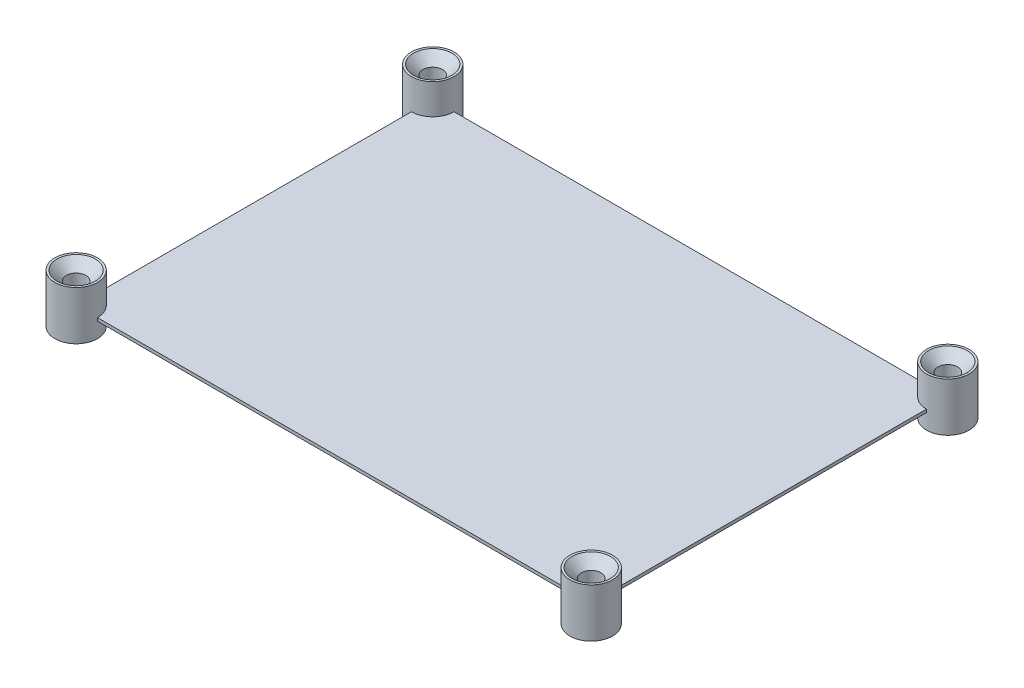
from build123d import *

# Parameters (mm, degrees)
SKETCH2_W                                       = 84.5
SKETCH2_H                                       = 58.5
BOSS_EXTRUDE1_DEPTH                             = 0.5
BOSS_EXTRUDE2_DEPTH                             = 5
BOSS_EXTRUDE2_DEPTH_BACK                        = 3
SKETCH3_R                                       = 3.5
BOSS_EXTRUDE3_DEPTH                             = 5
BOSS_EXTRUDE3_DEPTH_BACK                        = 3
SKETCH5_R                                       = 3.5
BOSS_EXTRUDE4_DEPTH                             = 5
BOSS_EXTRUDE4_DEPTH_BACK                        = 3
SKETCH6_R                                       = 3.5
BOSS_EXTRUDE5_DEPTH                             = 5
BOSS_EXTRUDE5_DEPTH_BACK                        = 3
SKETCH7_R                                       = 3.5
CSK_FOR_M3_FLAT_HEAD_MACHINE_SCREW1_D           = 3.2
CSK_FOR_M3_FLAT_HEAD_MACHINE_SCREW1_DEPTH       = 13.03862301
CSK_FOR_M3_FLAT_HEAD_MACHINE_SCREW1_CSINK_D     = 6.3
CSK_FOR_M3_FLAT_HEAD_MACHINE_SCREW1_CSINK_ANGLE = 90
CSK_FOR_M3_FLAT_HEAD_MACHINE_SCREW1_TIP         = 0.96137699
CSK_FOR_M3_FLAT_HEAD_MACHINE_SCREW2_D           = 3.2
CSK_FOR_M3_FLAT_HEAD_MACHINE_SCREW2_DEPTH       = 13.03862301
CSK_FOR_M3_FLAT_HEAD_MACHINE_SCREW2_CSINK_D     = 6.3
CSK_FOR_M3_FLAT_HEAD_MACHINE_SCREW2_CSINK_ANGLE = 90
CSK_FOR_M3_FLAT_HEAD_MACHINE_SCREW2_TIP         = 0.96137699
CSK_FOR_M3_FLAT_HEAD_MACHINE_SCREW3_D           = 3.2
CSK_FOR_M3_FLAT_HEAD_MACHINE_SCREW3_DEPTH       = 13.03862301
CSK_FOR_M3_FLAT_HEAD_MACHINE_SCREW3_CSINK_D     = 6.3
CSK_FOR_M3_FLAT_HEAD_MACHINE_SCREW3_CSINK_ANGLE = 90
CSK_FOR_M3_FLAT_HEAD_MACHINE_SCREW3_TIP         = 0.96137699
CSK_FOR_M3_FLAT_HEAD_MACHINE_SCREW4_D           = 3.2
CSK_FOR_M3_FLAT_HEAD_MACHINE_SCREW4_DEPTH       = 13.03862301
CSK_FOR_M3_FLAT_HEAD_MACHINE_SCREW4_CSINK_D     = 6.3
CSK_FOR_M3_FLAT_HEAD_MACHINE_SCREW4_CSINK_ANGLE = 90
CSK_FOR_M3_FLAT_HEAD_MACHINE_SCREW4_TIP         = 0.96137699


with BuildPart() as part:
    # Sketch2 → Boss-Extrude1 (new body)
    with BuildSketch(Plane(origin=(0, 0, 0), x_dir=(1, 0, 0), z_dir=(0, 1, 0))):
        with Locations((-42.25, -29.25)):
            Rectangle(SKETCH2_W, SKETCH2_H)
    extrude(amount=BOSS_EXTRUDE1_DEPTH)

    # Sketch3 → Boss-Extrude2 (add, two sides: drawn at the far end of the back side and taken through both)
    with BuildSketch(Plane(origin=(0, 0.5, 0), x_dir=(1, 0, 0), z_dir=(0, 1, 0)).offset(-BOSS_EXTRUDE2_DEPTH_BACK)):
        with Locations(Location((-84.5, 0, 0), (0, 0, 270))):
            Circle(SKETCH3_R)
    extrude(amount=BOSS_EXTRUDE2_DEPTH + BOSS_EXTRUDE2_DEPTH_BACK)

    # Sketch5 → Boss-Extrude3 (add, two sides: drawn at the far end of the back side and taken through both)
    with BuildSketch(Plane(origin=(0, 0.5, 0), x_dir=(1, 0, 0), z_dir=(0, 1, 0)).offset(-BOSS_EXTRUDE3_DEPTH_BACK)):
        with Locations(Location((-84.5, -58.5, 0), (0, 0, 270))):
            Circle(SKETCH5_R)
    extrude(amount=BOSS_EXTRUDE3_DEPTH + BOSS_EXTRUDE3_DEPTH_BACK)

    # Sketch6 → Boss-Extrude4 (add, two sides: drawn at the far end of the back side and taken through both)
    with BuildSketch(Plane(origin=(0, 0.5, 0), x_dir=(1, 0, 0), z_dir=(0, 1, 0)).offset(-BOSS_EXTRUDE4_DEPTH_BACK)):
        with Locations(Location((0, -58.5, 0), (0, 0, 270))):
            Circle(SKETCH6_R)
    extrude(amount=BOSS_EXTRUDE4_DEPTH + BOSS_EXTRUDE4_DEPTH_BACK)

    # Sketch7 → Boss-Extrude5 (add, two sides: drawn at the far end of the back side and taken through both)
    with BuildSketch(Plane(origin=(0, 0.5, 0), x_dir=(1, 0, 0), z_dir=(0, 1, 0)).offset(-BOSS_EXTRUDE5_DEPTH_BACK)):
        with Locations(Location((0, 0, 0), (0, 0, 270))):
            Circle(SKETCH7_R)
    extrude(amount=BOSS_EXTRUDE5_DEPTH + BOSS_EXTRUDE5_DEPTH_BACK)

    # CSK for M3 Flat Head Machine Screw1
    with Locations(Plane(origin=(0, 5.5, 0), x_dir=(1, 0, 0), z_dir=(0, 1, 0))):
        with Locations((-84.5, 0)):
            CounterSinkHole(CSK_FOR_M3_FLAT_HEAD_MACHINE_SCREW1_D / 2, CSK_FOR_M3_FLAT_HEAD_MACHINE_SCREW1_CSINK_D / 2, depth=CSK_FOR_M3_FLAT_HEAD_MACHINE_SCREW1_DEPTH, counter_sink_angle=CSK_FOR_M3_FLAT_HEAD_MACHINE_SCREW1_CSINK_ANGLE)
            with Locations((0, 0, -(CSK_FOR_M3_FLAT_HEAD_MACHINE_SCREW1_DEPTH + CSK_FOR_M3_FLAT_HEAD_MACHINE_SCREW1_TIP / 2))):  # 118° drill point
                Cone(0, CSK_FOR_M3_FLAT_HEAD_MACHINE_SCREW1_D / 2, CSK_FOR_M3_FLAT_HEAD_MACHINE_SCREW1_TIP, mode=Mode.SUBTRACT)

    # CSK for M3 Flat Head Machine Screw2
    with Locations(Plane(origin=(0, 5.5, 0), x_dir=(1, 0, 0), z_dir=(0, 1, 0))):
        with Locations((-84.5, -58.5)):
            CounterSinkHole(CSK_FOR_M3_FLAT_HEAD_MACHINE_SCREW2_D / 2, CSK_FOR_M3_FLAT_HEAD_MACHINE_SCREW2_CSINK_D / 2, depth=CSK_FOR_M3_FLAT_HEAD_MACHINE_SCREW2_DEPTH, counter_sink_angle=CSK_FOR_M3_FLAT_HEAD_MACHINE_SCREW2_CSINK_ANGLE)
            with Locations((0, 0, -(CSK_FOR_M3_FLAT_HEAD_MACHINE_SCREW2_DEPTH + CSK_FOR_M3_FLAT_HEAD_MACHINE_SCREW2_TIP / 2))):  # 118° drill point
                Cone(0, CSK_FOR_M3_FLAT_HEAD_MACHINE_SCREW2_D / 2, CSK_FOR_M3_FLAT_HEAD_MACHINE_SCREW2_TIP, mode=Mode.SUBTRACT)

    # CSK for M3 Flat Head Machine Screw3
    with Locations(Plane(origin=(0, 5.5, 0), x_dir=(1, 0, 0), z_dir=(0, 1, 0))):
        with Locations((0, 0)):
            CounterSinkHole(CSK_FOR_M3_FLAT_HEAD_MACHINE_SCREW3_D / 2, CSK_FOR_M3_FLAT_HEAD_MACHINE_SCREW3_CSINK_D / 2, depth=CSK_FOR_M3_FLAT_HEAD_MACHINE_SCREW3_DEPTH, counter_sink_angle=CSK_FOR_M3_FLAT_HEAD_MACHINE_SCREW3_CSINK_ANGLE)
            with Locations((0, 0, -(CSK_FOR_M3_FLAT_HEAD_MACHINE_SCREW3_DEPTH + CSK_FOR_M3_FLAT_HEAD_MACHINE_SCREW3_TIP / 2))):  # 118° drill point
                Cone(0, CSK_FOR_M3_FLAT_HEAD_MACHINE_SCREW3_D / 2, CSK_FOR_M3_FLAT_HEAD_MACHINE_SCREW3_TIP, mode=Mode.SUBTRACT)

    # CSK for M3 Flat Head Machine Screw4
    with Locations(Plane(origin=(0, 5.5, 0), x_dir=(1, 0, 0), z_dir=(0, 1, 0))):
        with Locations((0, -58.5)):
            CounterSinkHole(CSK_FOR_M3_FLAT_HEAD_MACHINE_SCREW4_D / 2, CSK_FOR_M3_FLAT_HEAD_MACHINE_SCREW4_CSINK_D / 2, depth=CSK_FOR_M3_FLAT_HEAD_MACHINE_SCREW4_DEPTH, counter_sink_angle=CSK_FOR_M3_FLAT_HEAD_MACHINE_SCREW4_CSINK_ANGLE)
            with Locations((0, 0, -(CSK_FOR_M3_FLAT_HEAD_MACHINE_SCREW4_DEPTH + CSK_FOR_M3_FLAT_HEAD_MACHINE_SCREW4_TIP / 2))):  # 118° drill point
                Cone(0, CSK_FOR_M3_FLAT_HEAD_MACHINE_SCREW4_D / 2, CSK_FOR_M3_FLAT_HEAD_MACHINE_SCREW4_TIP, mode=Mode.SUBTRACT)


solid = part.part
